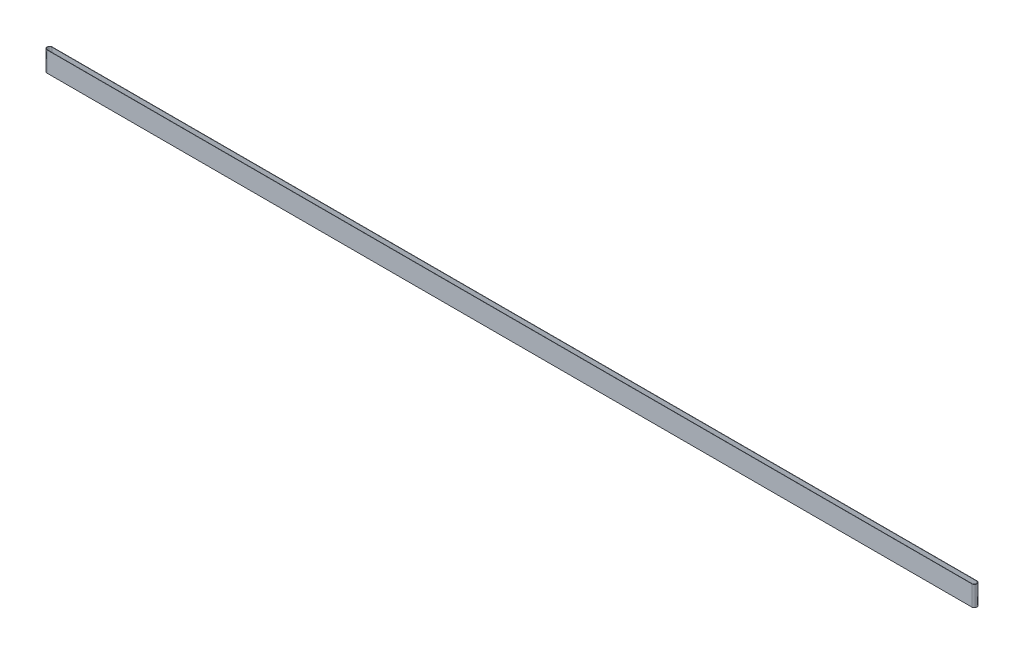
from build123d import *

# Parameters (mm, degrees)
EXTRUDE_1_DEPTH = 39


with BuildPart() as part:
    # 草图1 → 凸台-拉伸1 (new body)
    with BuildSketch(Plane(origin=(0, 0, 0), x_dir=(1, 0, 0), z_dir=(0, 1, 0))):
        with BuildLine():
            Line((0, 5), (1790, 5))
            ThreePointArc((1790, 5), (1795, 0), (1790, -5))
            Line((1790, -5), (0, -5))
            ThreePointArc((0, -5), (-5, 0), (0, 5))
        make_face()
        with BuildLine():
            Line((0, 4.5), (1790, 4.5))
            ThreePointArc((1790, 4.5), (1794.5, 0), (1790, -4.5))
            Line((1790, -4.5), (0, -4.5))
            ThreePointArc((0, -4.5), (-4.5, 0), (0, 4.5))
        make_face(mode=Mode.SUBTRACT)
    extrude(amount=EXTRUDE_1_DEPTH)


solid = part.part
